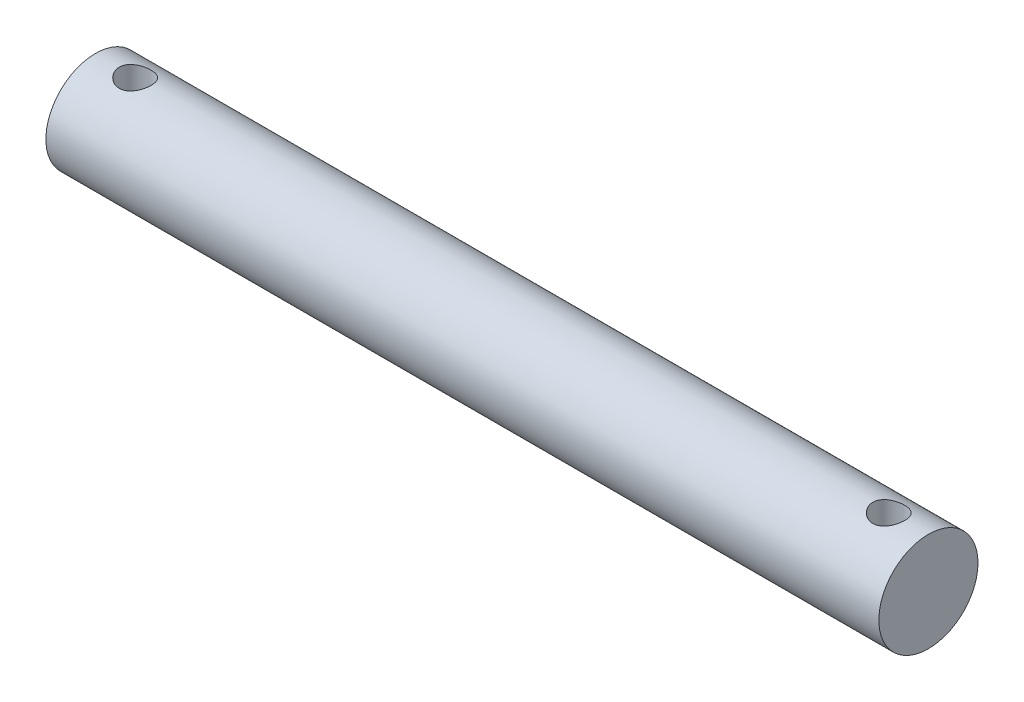
from build123d import *

# Parameters (mm, degrees)
SKETCH1_R               = 12.5
BOSS_EXTRUDE1_DEPTH     = 210
CUT_EXTRUDE1_DEPTH      = 211.742734157
CUT_EXTRUDE1_DEPTH_BACK = 211.742734157
SKETCH2_R               = 4


with BuildPart() as part:
    # Sketch1 → Boss-Extrude1 (new body)
    with BuildSketch(Plane(origin=(0, 0, 0), x_dir=(0, 0, -1), z_dir=(1, 0, 0))):
        Circle(SKETCH1_R)
    extrude(amount=BOSS_EXTRUDE1_DEPTH)

    # Sketch2 → Cut-Extrude1 (cut, two sides: drawn at the far end of the back side and taken through both)
    with BuildSketch(Plane(origin=(0, 0, 0), x_dir=(1, 0, 0), z_dir=(0, 1, 0)).offset(-CUT_EXTRUDE1_DEPTH_BACK)):
        with Locations(Location((10, 0, 0), (0, 0, 270))):
            Circle(SKETCH2_R)
        with Locations(Location((200, 0, 0), (0, 0, 270))):
            Circle(SKETCH2_R)
    extrude(amount=CUT_EXTRUDE1_DEPTH + CUT_EXTRUDE1_DEPTH_BACK, mode=Mode.SUBTRACT)


solid = part.part
